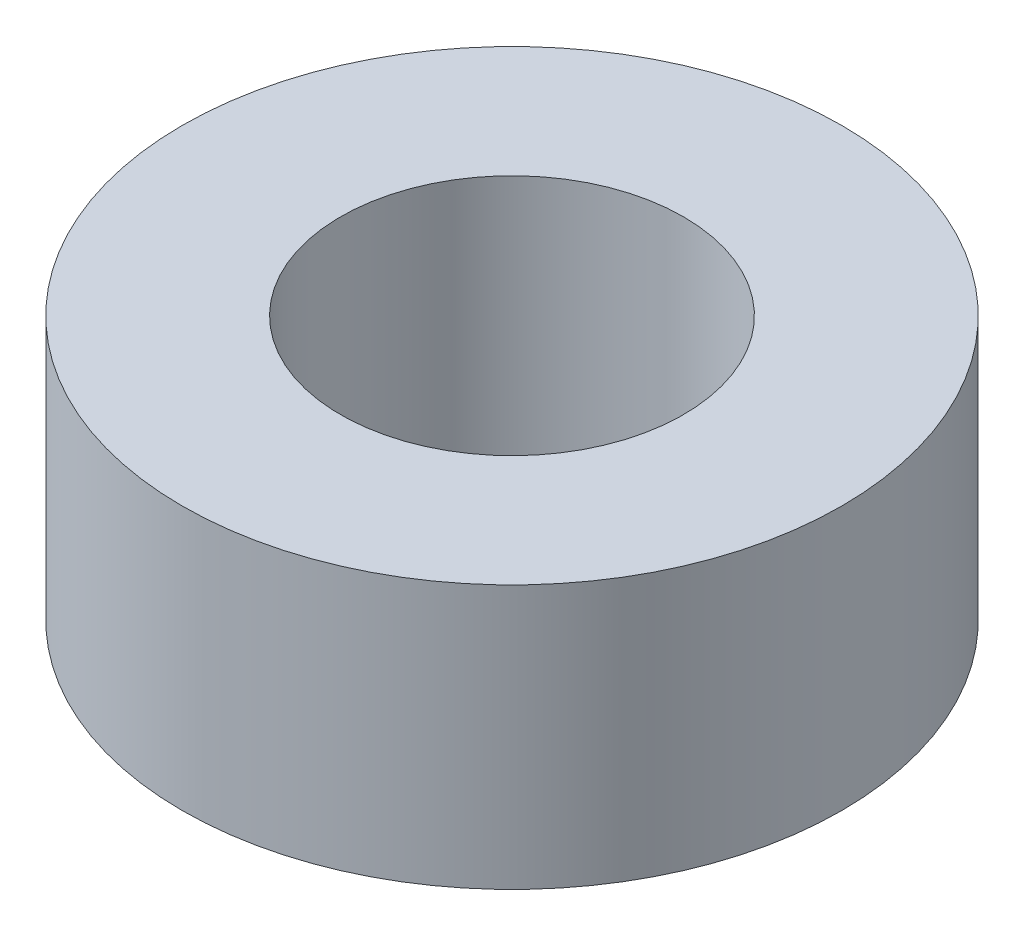
from build123d import *

# Parameters (mm, degrees)
SKETCH1_R           = 9.525
SKETCH1_R_2         = 4.953
BOSS_EXTRUDE1_DEPTH = 7.62


with BuildPart() as part:
    # Sketch1 → Boss-Extrude1 (new body)
    with BuildSketch(Plane(origin=(0, 0, 0), x_dir=(1, 0, 0), z_dir=(0, 1, 0))):
        with Locations(Location((0, 0, 0), (0, 0, 90))):
            Circle(SKETCH1_R)
        with Locations(Location((0, 0, 0), (0, 0, 90))):
            Circle(SKETCH1_R_2, mode=Mode.SUBTRACT)
    extrude(amount=BOSS_EXTRUDE1_DEPTH)


solid = part.part
